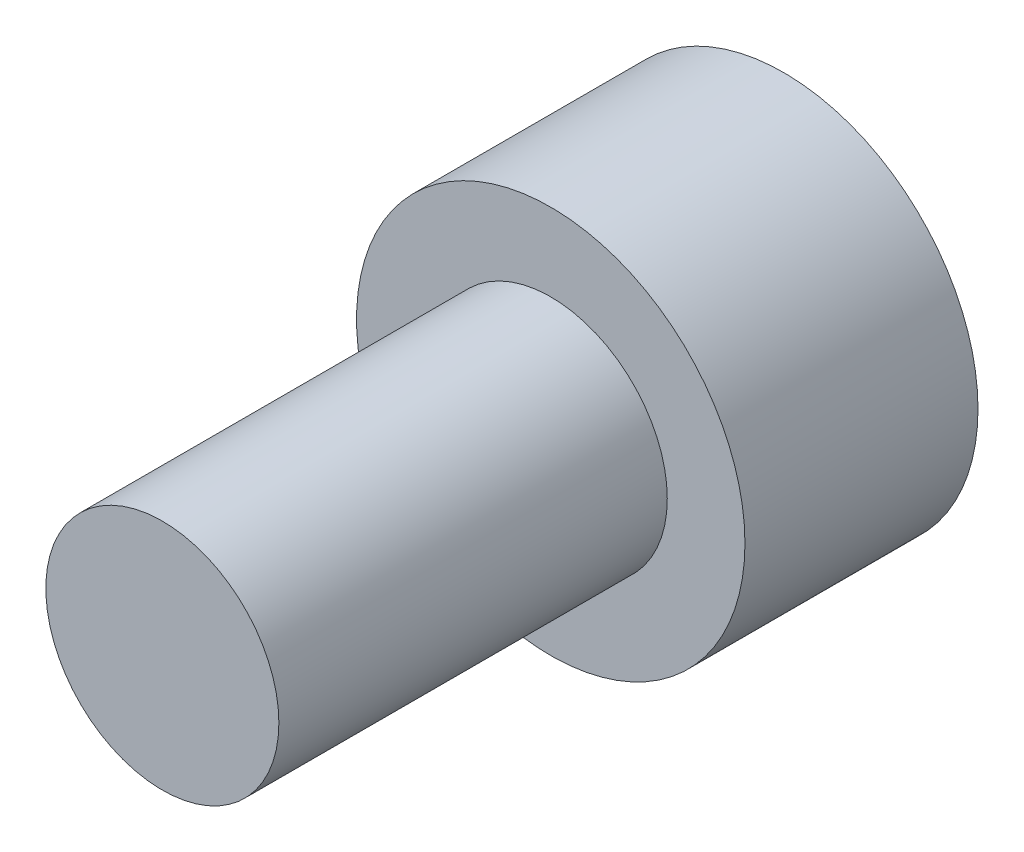
from build123d import *

# Parameters (mm, degrees)
SKETCH_1_R          = 5
EXTRUDE_1_DEPTH     = 6
SKETCH_2_R          = 3
EXTRUDE_2_DEPTH     = 10
CUT_EXTRUDE_1_DEPTH = 3


with BuildPart() as part:
    # ｽｹｯﾁ1 → ﾎﾞｽ - 押し出し1 (new body)
    with BuildSketch(Plane.XY):
        Circle(SKETCH_1_R)
    extrude(amount=EXTRUDE_1_DEPTH)

    # ｽｹｯﾁ2 → ﾎﾞｽ - 押し出し2 (add)
    with BuildSketch(Plane.XY.offset(6)):
        Circle(SKETCH_2_R)
    extrude(amount=EXTRUDE_2_DEPTH)

    # ｽｹｯﾁ3 → ｶｯﾄ - 押し出し1 (cut)
    with BuildSketch(Plane(origin=(0, 0, 0), x_dir=(-1, 0, 0), z_dir=(0, 0, -1))):
        Polygon((2.444628194, 2.36158951), (-0.822882412, 3.297904873), (-3.267510606, 0.936315364), (-2.444628194, -2.36158951), (0.822882412, -3.297904873), (3.267510606, -0.936315364), align=None)
    extrude(amount=-CUT_EXTRUDE_1_DEPTH, mode=Mode.SUBTRACT)


solid = part.part
